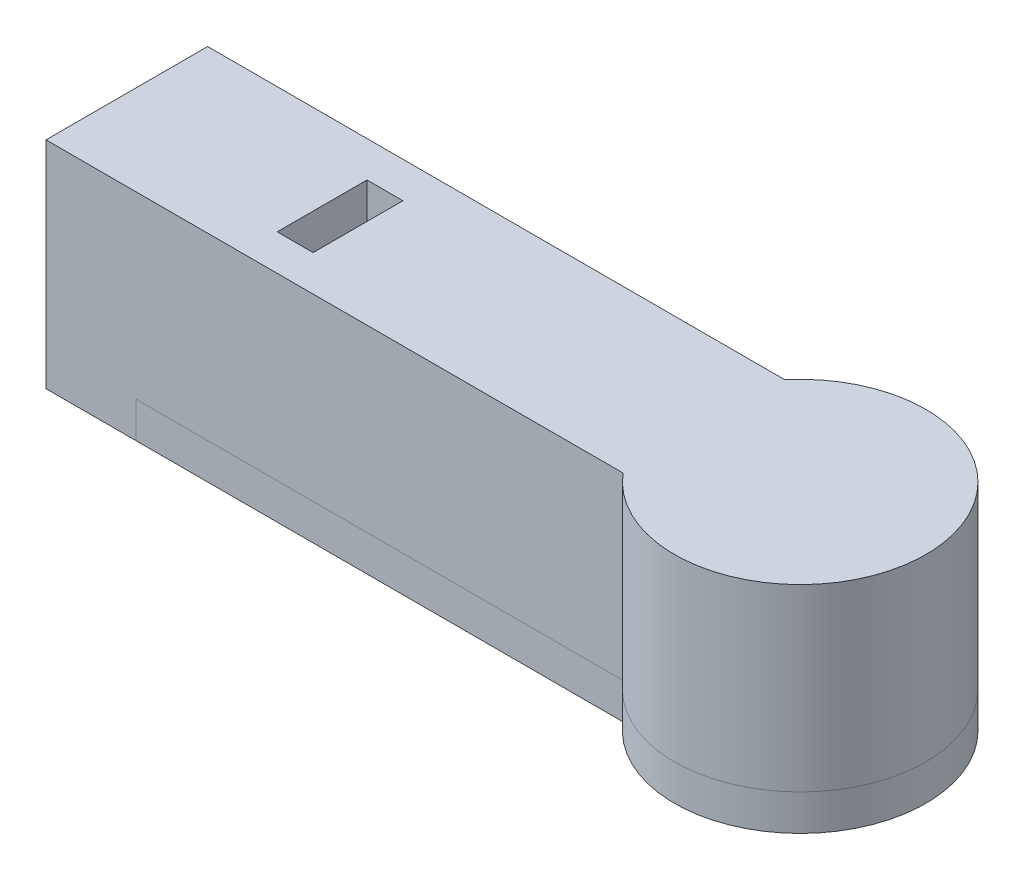
from build123d import *

# Parameters (mm, degrees)
BOSS_EXTRUDE1_DEPTH = 2
BOSS_EXTRUDE2_DEPTH = 8
SKETCH3_R           = 3
CUT_EXTRUDE1_DEPTH  = 5
SKETCH4_W           = 2
SKETCH4_H           = 5
CUT_EXTRUDE2_DEPTH  = 5
BOSS_EXTRUDE3_START = 5
SKETCH5_W           = 9
SKETCH5_H           = 12
SKETCH5_R           = 3
BOSS_EXTRUDE3_DEPTH = 5
SKETCH6_R           = 3.5
BOSS_EXTRUDE4_DEPTH = 2


with BuildPart() as part:
    # Sketch1 → Boss-Extrude1 (new body)
    with BuildSketch(Plane(origin=(0, 0, 0), x_dir=(1, 0, 0), z_dir=(0, 1, 0))):
        with BuildLine():
            Line((0, 3.400993316), (27.129560965, 3.400993316))
            ThreePointArc((27.129560965, 3.400993316), (39.491463612, -1.099006684), (27.129560965, -5.599006684))
            Line((27.129560965, -5.599006684), (0, -5.599006684))
            Line((0, -5.599006684), (0, 3.400993316))
        make_face()
    extrude(amount=-BOSS_EXTRUDE1_DEPTH)

    # Sketch2 → Boss-Extrude2 (add)
    with BuildSketch(Plane.XZ.offset(2)):
        with BuildLine():
            Line((0, 5.599006684), (27.129560965, 5.599006684))
            ThreePointArc((27.129560965, 5.599006684), (39.491463612, 1.099006684), (27.129560965, -3.400993316))
            Line((27.129560965, -3.400993316), (0, -3.400993316))
            Line((0, -3.400993316), (0, 5.599006684))
        make_face()
        with BuildLine():
            Line((4, 3.599006684), (28.161336593, 3.599006684))
            ThreePointArc((28.161336593, 3.599006684), (37.491463612, 1.099006684), (28.161336593, -1.400993316))
            Line((28.161336593, -1.400993316), (4, -1.400993316))
            Line((4, -1.400993316), (4, 3.599006684))
        make_face(mode=Mode.SUBTRACT)
    extrude(amount=BOSS_EXTRUDE2_DEPTH)

    # Sketch3 → Cut-Extrude1 (cut)
    with BuildSketch(Plane.ZY):
        with Locations((1.099006684, -5)):
            Circle(SKETCH3_R)
    extrude(amount=-CUT_EXTRUDE1_DEPTH, mode=Mode.SUBTRACT)

    # Sketch4 → Cut-Extrude2 (cut)
    with BuildSketch(Plane.XZ.offset(2)):
        with Locations((6.871712495, 1.099006684)):
            Rectangle(SKETCH4_W, SKETCH4_H)
    extrude(amount=-CUT_EXTRUDE2_DEPTH, mode=Mode.SUBTRACT)

    # Sketch5 → Boss-Extrude3 (add)
    with BuildSketch(Plane.ZY.offset(BOSS_EXTRUDE3_START)):
        with Locations((1.099006684, -6)):
            Rectangle(SKETCH5_W, SKETCH5_H)
        with Locations((1.099006684, -5)):
            Circle(SKETCH5_R, mode=Mode.SUBTRACT)
    extrude(amount=-BOSS_EXTRUDE3_DEPTH)


with BuildPart() as body_2:
    # Sketch6 → Boss-Extrude4 (new body)
    with BuildSketch(Plane.XZ.offset(10)):
        with BuildLine():
            Line((0, 5.599006684), (27.129560965, 5.599006684))
            ThreePointArc((27.129560965, 5.599006684), (39.491463612, 1.099006684), (27.129560965, -3.400993316))
            Line((27.129560965, -3.400993316), (0, -3.400993316))
            Line((0, -3.400993316), (0, 5.599006684))
        make_face()
        with Locations(Location((32.491463612, 1.099006684, 0), (0, 0, 270))):
            Circle(SKETCH6_R, mode=Mode.SUBTRACT)
    extrude(amount=BOSS_EXTRUDE4_DEPTH)


solid = Compound([part.part, body_2.part])
